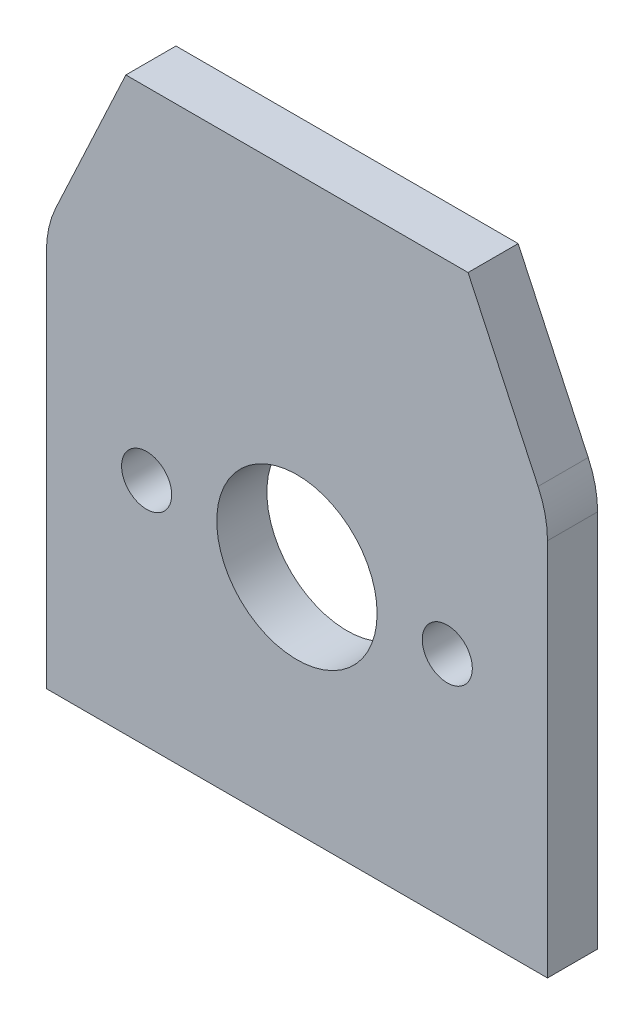
from build123d import *

# Parameters (mm, degrees)
SKETCH1_R           = 8
SKETCH1_R_2         = 2.5
BOSS_EXTRUDE1_DEPTH = 2.5


with BuildPart() as part:
    # Sketch1 → Boss-Extrude1 (new, symmetric)
    with BuildSketch(Plane.XY):
        with BuildLine():
            Line((-25, 0), (-25, 37.783053374))
            ThreePointArc((-25, 37.783053374), (-24.762960071, 39.947449513), (-24.06307787, 42.009235991))
            Line((-24.06307787, 42.009235991), (-17.072769811, 57))
            Line((-17.072769811, 57), (17.072769811, 57))
            Line((17.072769811, 57), (24.06307787, 42.009235991))
            ThreePointArc((24.06307787, 42.009235991), (24.762960071, 39.947449513), (25, 37.783053374))
            Line((25, 37.783053374), (25, 0))
            Line((25, 0), (-25, 0))
        make_face()
        with Locations((0, 23)):
            Circle(SKETCH1_R, mode=Mode.SUBTRACT)
        with Locations((-15, 23)):
            Circle(SKETCH1_R_2, mode=Mode.SUBTRACT)
        with Locations((15, 23)):
            Circle(SKETCH1_R_2, mode=Mode.SUBTRACT)
    extrude(amount=BOSS_EXTRUDE1_DEPTH, both=True)


solid = part.part
